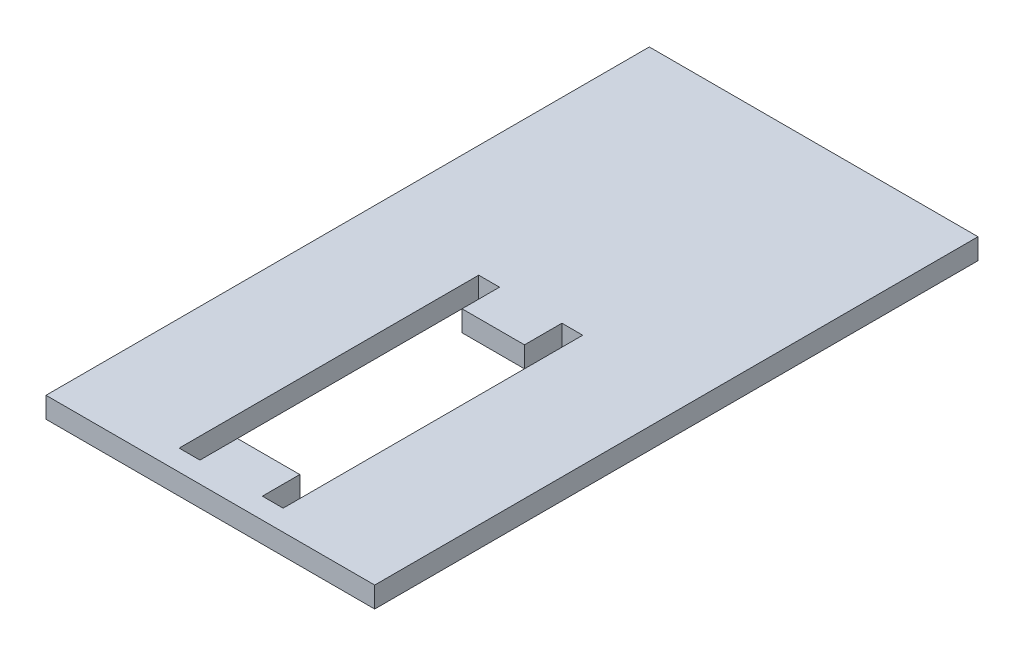
from build123d import *

# Parameters (mm, degrees)
ESQUISSE1_W      = 79
ESQUISSE1_H      = 145
EXTRUSION1_DEPTH = 5
EXTRUSION2_REACH = 110.909


with BuildPart() as part:
    # Esquisse1 → Extrusion1 (new body)
    with BuildSketch(Plane(origin=(0, 0, 0), x_dir=(1, 0, 0), z_dir=(0, 1, 0))):
        with Locations((-4.262748952, -27.104127358)):
            Rectangle(ESQUISSE1_W, ESQUISSE1_H)
    extrude(amount=EXTRUSION1_DEPTH)

    # Esquisse2 → Extrusion2 (cut, up to next)
    with BuildSketch(Plane(origin=(0, 5, 0), x_dir=(1, 0, 0), z_dir=(0, 1, 0)), mode=Mode.PRIVATE) as extrusion2_sk1:
        Polygon((-16.762748952, -22.604127358), (-11.762748952, -22.604127358), (-11.762748952, -31.604127358), (3.237251048, -31.604127358), (3.237251048, -22.604127358), (8.237251048, -22.604127358), (8.237251048, -94.604127358), (3.237251048, -94.604127358), (3.237251048, -85.604127358), (-11.762748952, -85.604127358), (-11.762748952, -94.604127358), (-16.762748952, -94.604127358), align=None)
    extrusion2_tool1 = extrude(extrusion2_sk1.sketch, amount=-EXTRUSION2_REACH, mode=Mode.PRIVATE) & part.part
    add(extrusion2_tool1.solids().sort_by_distance((-4.262749, 5, 58.604127))[0], mode=Mode.SUBTRACT)


solid = part.part
